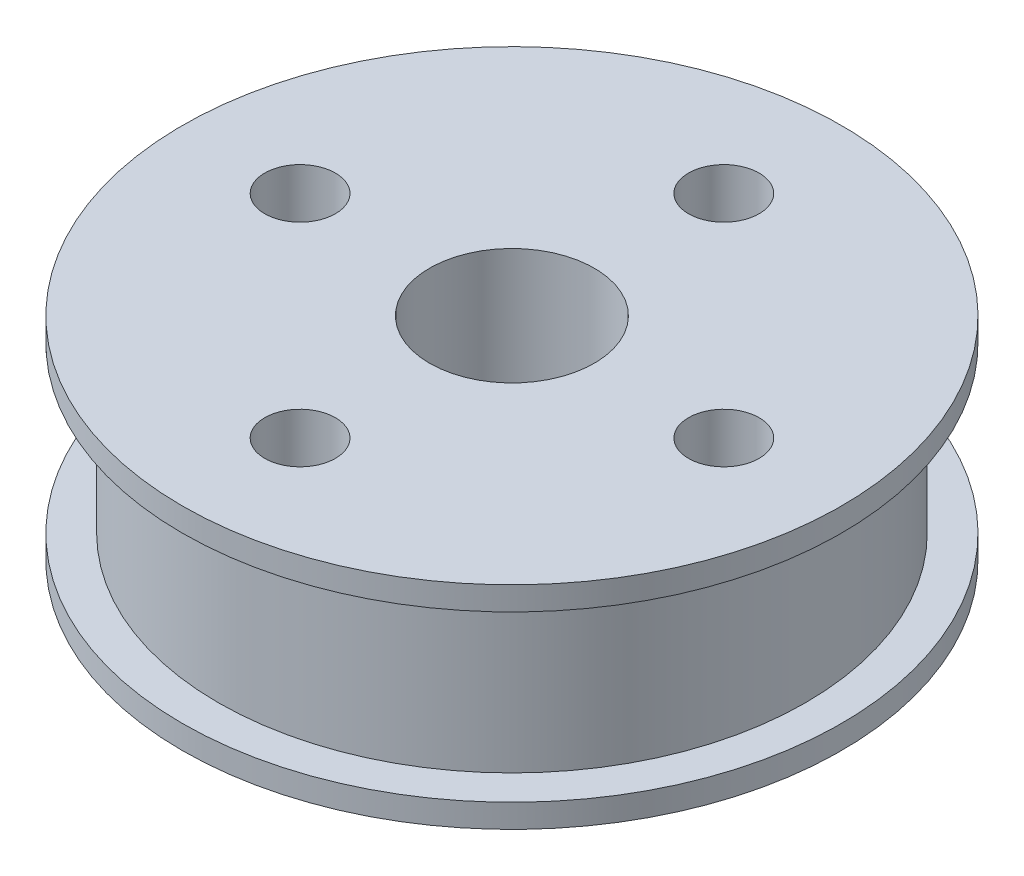
from build123d import *

# Parameters (mm, degrees)
SKETCH1_R           = 14
BOSS_EXTRUDE1_DEPTH = 1
SKETCH2_R           = 12.475
BOSS_EXTRUDE2_DEPTH = 7
SKETCH3_R           = 14
BOSS_EXTRUDE3_DEPTH = 1
SKETCH4_R           = 3.5
CUT_EXTRUDE1_DEPTH  = 22.748563171
SKETCH5_R           = 1.5
CUT_EXTRUDE2_DEPTH  = 22.748563171
CIRPATTERN1_COUNT   = 4


with BuildPart() as part:
    # Sketch1 → Boss-Extrude1 (new body)
    with BuildSketch(Plane(origin=(0, 0, 0), x_dir=(1, 0, 0), z_dir=(0, 1, 0))):
        with Locations(Location((0, 0, 0), (0, 0, 270))):
            Circle(SKETCH1_R)
    extrude(amount=BOSS_EXTRUDE1_DEPTH)

    # Sketch2 → Boss-Extrude2 (add)
    with BuildSketch(Plane(origin=(0, 1, 0), x_dir=(1, 0, 0), z_dir=(0, 1, 0))):
        with Locations(Location((0, 0, 0), (0, 0, 270))):
            Circle(SKETCH2_R)
    extrude(amount=BOSS_EXTRUDE2_DEPTH)

    # Sketch3 → Boss-Extrude3 (add)
    with BuildSketch(Plane(origin=(0, 8, 0), x_dir=(1, 0, 0), z_dir=(0, 1, 0))):
        with Locations(Location((0, 0, 0), (0, 0, 270))):
            Circle(SKETCH3_R)
    extrude(amount=BOSS_EXTRUDE3_DEPTH)

    # Sketch4 → Cut-Extrude1 (cut, through all)
    with BuildSketch(Plane(origin=(0, 9, 0), x_dir=(1, 0, 0), z_dir=(0, 1, 0))):
        with Locations(Location((0, 0, 0), (0, 0, 270))):
            Circle(SKETCH4_R)
    extrude(amount=-CUT_EXTRUDE1_DEPTH, mode=Mode.SUBTRACT)

    # Sketch5 → Cut-Extrude2 (cut, through all)
    with BuildSketch(Plane(origin=(0, 9, 0), x_dir=(1, 0, 0), z_dir=(0, 1, 0))):
        with Locations(Location((0, 9, 0), (0, 0, 270))):
            Circle(SKETCH5_R)
    cut_extrude2 = extrude(amount=-CUT_EXTRUDE2_DEPTH, mode=Mode.SUBTRACT)

    # CirPattern1: Cut-Extrude2 ×4 about axis
    cirpattern1_axis = Axis((0, 0, 0), (0, 1, 0))
    for i in range(1, CIRPATTERN1_COUNT):
        add(cut_extrude2.rotate(cirpattern1_axis, i * 360 / CIRPATTERN1_COUNT), mode=Mode.SUBTRACT)


solid = part.part
